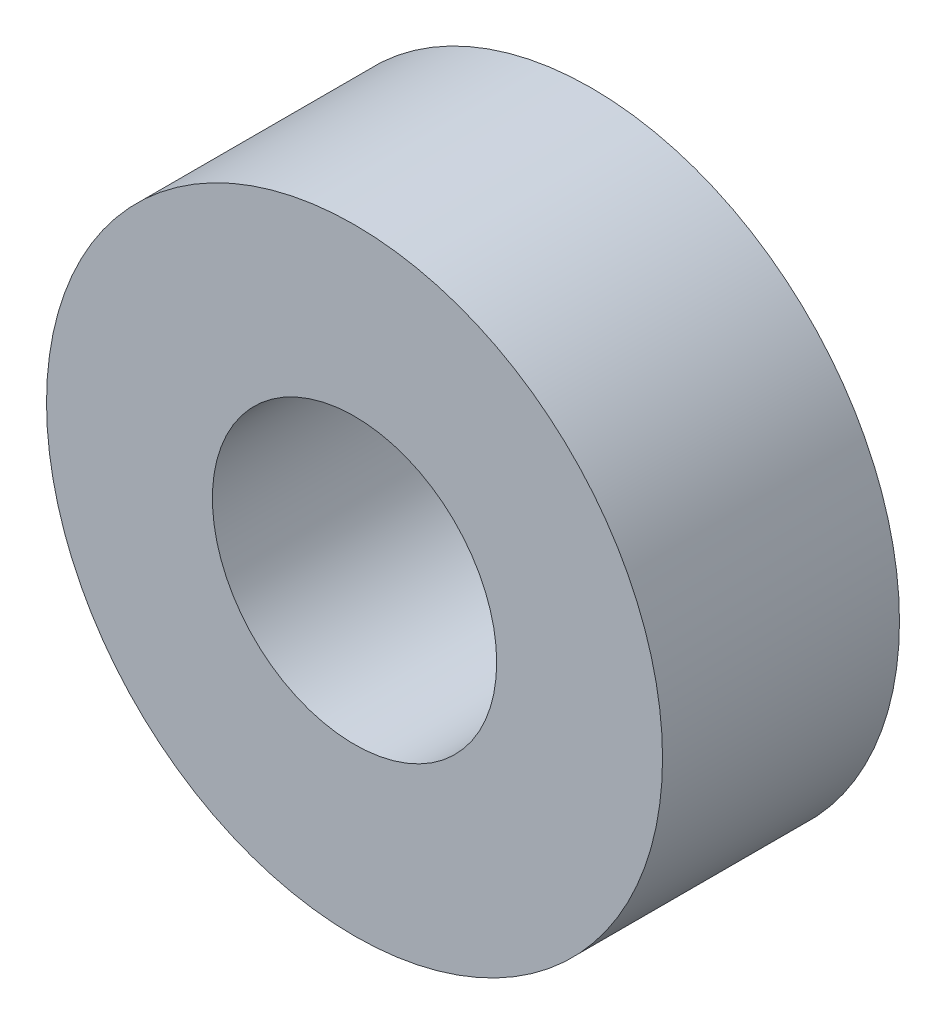
from build123d import *

# Parameters (mm, degrees)
SKETCH_1_R          = 6.5
EXTRUDE_1_DEPTH     = 5
SKETCH_2_R          = 3
CUT_EXTRUDE_1_DEPTH = 5


with BuildPart() as part:
    # 草图1 → 凸台-拉伸1 (new body)
    with BuildSketch(Plane.XY):
        Circle(SKETCH_1_R)
    extrude(amount=EXTRUDE_1_DEPTH)

    # 草图2 → 切除-拉伸1 (cut)
    with BuildSketch(Plane.XY.offset(5)):
        Circle(SKETCH_2_R)
    extrude(amount=-CUT_EXTRUDE_1_DEPTH, mode=Mode.SUBTRACT)


solid = part.part
